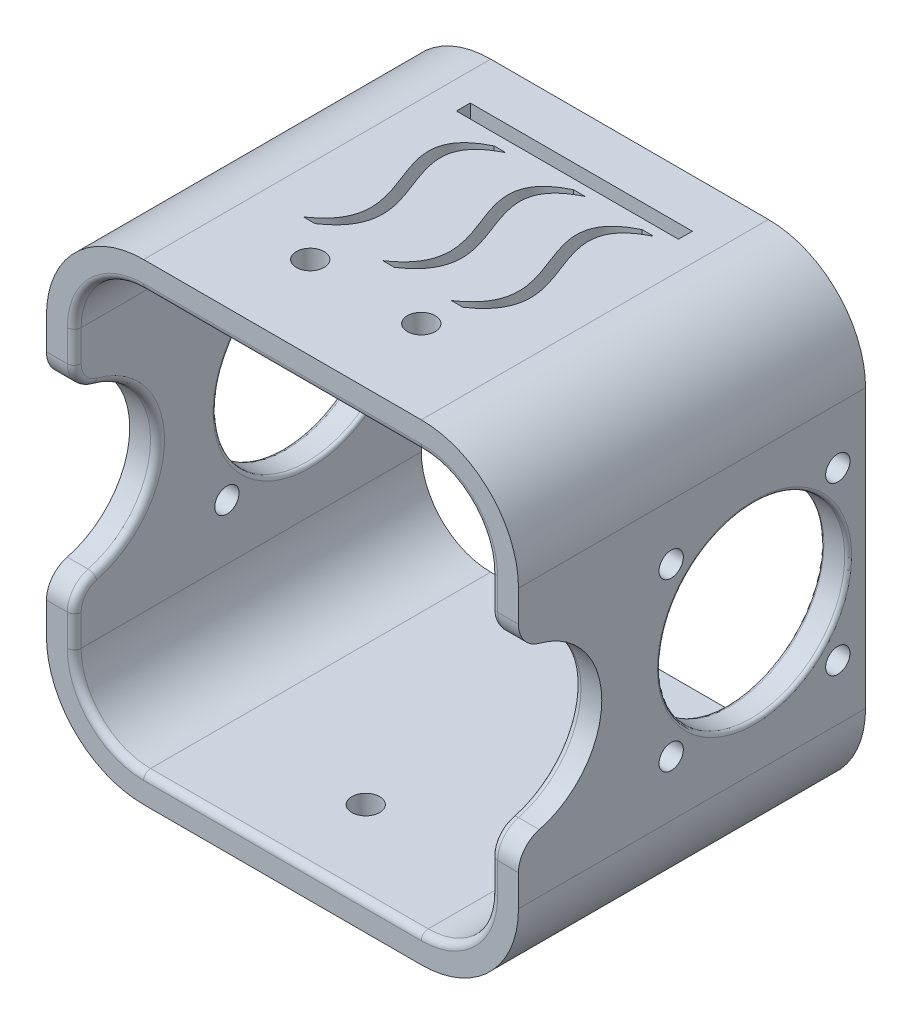
from build123d import *

# Parameters (mm, degrees)
ESTRUSIONE_SOTTILE1_DEPTH = 50
SCHIZZO2_R                = 2
TAGLIO_ESTRUSIONE1_DEPTH  = 10
SCHIZZO3_R                = 12
TAGLIO_ESTRUSIONE2_DEPTH  = 68
RACCORDO1_R               = 4
RACCORDO2_R               = 4
RACCORDO3_R               = 4
RACCORDO4_R               = 4
SCHIZZO4_R                = 2
TAGLIO_ESTRUSIONE3_DEPTH  = 10
SCHIZZO5_W                = 32
SCHIZZO5_H                = 2
TAGLIO_ESTRUSIONE4_DEPTH  = 10
TAGLIO_ESTRUSIONE5_REACH  = 107.925
SCHIZZO7_R                = 1.75
TAGLIO_ESTRUSIONE6_REACH  = 107.925
SCHIZZO8_R                = 13.5
RACCORDO5_R               = 0.5
RACCORDO6_R               = 0.5
RACCORDO7_R               = 0.5
RACCORDO8_R               = 0.5
RACCORDO9_R               = 1


with BuildPart() as part:
    # Schizzo1 → Estrusione-Sottile1 (new body)
    with BuildSketch(Plane.XY):
        with BuildLine():
            Line((-64, -10), (-64, -50))
            ThreePointArc((-64, -50), (-59.899494937, -59.899494937), (-50, -64))
            Line((-50, -64), (-10, -64))
            ThreePointArc((-10, -64), (-0.100505063, -59.899494937), (4, -50))
            Line((4, -50), (4, -10))
            ThreePointArc((4, -10), (-0.100505063, -0.100505063), (-10, 4))
            Line((-10, 4), (-50, 4))
            ThreePointArc((-50, 4), (-59.899494937, -0.100505063), (-64, -10))
        make_face()
        with BuildLine():
            Line((-60, -10), (-60, -50))
            ThreePointArc((-60, -50), (-57.071067812, -57.071067812), (-50, -60))
            Line((-50, -60), (-10, -60))
            ThreePointArc((-10, -60), (-2.928932188, -57.071067812), (0, -50))
            Line((0, -50), (0, -10))
            ThreePointArc((0, -10), (-2.928932188, -2.928932188), (-10, 0))
            Line((-10, 0), (-50, 0))
            ThreePointArc((-50, 0), (-57.071067812, -2.928932188), (-60, -10))
        make_face(mode=Mode.SUBTRACT)
    extrude(amount=ESTRUSIONE_SOTTILE1_DEPTH)

    # Schizzo2 → Taglio-Estrusione1 (cut)
    with BuildSketch(Plane(origin=(0, 4, 0), x_dir=(1, 0, 0), z_dir=(0, 1, 0))):
        with Locations(Location((-38, -38, 0), (0, 0, 180))):
            Circle(SCHIZZO2_R)
        with Locations(Location((-22, -38, 0), (0, 0, 180))):
            Circle(SCHIZZO2_R)
    extrude(amount=-TAGLIO_ESTRUSIONE1_DEPTH, mode=Mode.SUBTRACT)

    # Schizzo3 → Taglio-Estrusione2 (cut)
    with BuildSketch(Plane.ZY.offset(64)):
        with Locations((50, -30)):
            Circle(SCHIZZO3_R)
    extrude(amount=-TAGLIO_ESTRUSIONE2_DEPTH, mode=Mode.SUBTRACT)

    # Raccordo1
    raccordo1_edges = [part.edges().sort_by_distance(p)[0] for p in [
        (-62, -18, 50),
    ]]
    fillet(raccordo1_edges, radius=RACCORDO1_R)

    # Raccordo2
    raccordo2_edges = [part.edges().sort_by_distance(p)[0] for p in [
        (-62, -42, 50),
    ]]
    fillet(raccordo2_edges, radius=RACCORDO2_R)

    # Raccordo3
    raccordo3_edges = [part.edges().sort_by_distance(p)[0] for p in [
        (2, -18, 50),
    ]]
    fillet(raccordo3_edges, radius=RACCORDO3_R)

    # Raccordo4
    raccordo4_edges = [part.edges().sort_by_distance(p)[0] for p in [
        (2, -42, 50),
    ]]
    fillet(raccordo4_edges, radius=RACCORDO4_R)

    # Schizzo4 → Taglio-Estrusione3 (cut)
    with BuildSketch(Plane.XZ.offset(64)):
        with Locations((-30, 38)):
            Circle(SCHIZZO4_R)
    extrude(amount=-TAGLIO_ESTRUSIONE3_DEPTH, mode=Mode.SUBTRACT)

    # Schizzo5 → Taglio-Estrusione4 (cut)
    with BuildSketch(Plane(origin=(0, 4, 0), x_dir=(1, 0, 0), z_dir=(0, 1, 0))):
        with Locations((-30, -7.945849316)):
            Rectangle(SCHIZZO5_W, SCHIZZO5_H)
        with BuildLine():
            Line((-30.960454742, -32.928721256), (-32.639127219, -32.919533938))
            add(Edge.make_bspline(
                [(-27.742758505, -10.323050859), (-39.164938897, -15.912155443), (-21.882006837, -25.659406976), (-32.639127219, -32.919533938)],
                knots=[0, 0, 0, 0, 1, 1, 1, 1], degree=3))
            Line((-27.742758505, -10.323050859), (-26.064086029, -10.332238178))
            add(Edge.make_bspline(
                [(-26.064086029, -10.332238178), (-37.486266421, -15.921342761), (-20.203334361, -25.668594294), (-30.960454742, -32.928721256)],
                knots=[0, 0, 0, 0, 1, 1, 1, 1], degree=3))
        make_face()
        with BuildLine():
            Line((-42.135720019, -33.181656302), (-43.814392495, -33.172468983))
            add(Edge.make_bspline(
                [(-38.918023781, -10.575985905), (-50.340204173, -16.165090488), (-33.057272113, -25.912342021), (-43.814392495, -33.172468983)],
                knots=[0, 0, 0, 0, 1, 1, 1, 1], degree=3))
            Line((-38.918023781, -10.575985905), (-37.239351305, -10.585173223))
            add(Edge.make_bspline(
                [(-37.239351305, -10.585173223), (-48.661531697, -16.174277806), (-31.378599637, -25.921529339), (-42.135720019, -33.181656302)],
                knots=[0, 0, 0, 0, 1, 1, 1, 1], degree=3))
        make_face()
        with BuildLine():
            Line((-21.047266541, -32.963061307), (-22.725939017, -32.953873989))
            add(Edge.make_bspline(
                [(-17.829570303, -10.35739091), (-29.251750695, -15.946495494), (-11.968818635, -25.693747027), (-22.725939017, -32.953873989)],
                knots=[0, 0, 0, 0, 1, 1, 1, 1], degree=3))
            Line((-17.829570303, -10.35739091), (-16.150897827, -10.366578228))
            add(Edge.make_bspline(
                [(-16.150897827, -10.366578228), (-27.573078219, -15.955682812), (-10.290146159, -25.702934345), (-21.047266541, -32.963061307)],
                knots=[0, 0, 0, 0, 1, 1, 1, 1], degree=3))
        make_face()
    extrude(amount=-TAGLIO_ESTRUSIONE4_DEPTH, mode=Mode.SUBTRACT)

    # Taglio-Estrusione5: up to this face of the body (flat: up to its plane)
    taglio_estrusione5_end = Plane(part.part.faces().sort_by_distance((4, -30, 22.393243333))[0])
    # Schizzo7 → Taglio-Estrusione5 (cut, up to the picked face)
    with BuildSketch(Plane.ZY.offset(64), mode=Mode.PRIVATE) as taglio_estrusione5_sk1:
        with Locations(Location((28, -18, 0), (0, 0, 270))):
            Circle(SCHIZZO7_R)
    taglio_estrusione5_tool1 = split(extrude(taglio_estrusione5_sk1.sketch, amount=-TAGLIO_ESTRUSIONE5_REACH, mode=Mode.PRIVATE), bisect_by=taglio_estrusione5_end, keep=Keep.BOTH, mode=Mode.PRIVATE)
    # Schizzo7 → Taglio-Estrusione5 (cut, up to the picked face)
    with BuildSketch(Plane.ZY.offset(64), mode=Mode.PRIVATE) as taglio_estrusione5_sk2:
        with Locations(Location((28, -42, 0), (0, 0, 90))):
            Circle(SCHIZZO7_R)
    taglio_estrusione5_tool2 = split(extrude(taglio_estrusione5_sk2.sketch, amount=-TAGLIO_ESTRUSIONE5_REACH, mode=Mode.PRIVATE), bisect_by=taglio_estrusione5_end, keep=Keep.BOTH, mode=Mode.PRIVATE)
    # Schizzo7 → Taglio-Estrusione5 (cut, up to the picked face)
    with BuildSketch(Plane.ZY.offset(64), mode=Mode.PRIVATE) as taglio_estrusione5_sk3:
        with Locations(Location((4, -42, 0), (0, 0, 270))):
            Circle(SCHIZZO7_R)
    taglio_estrusione5_tool3 = split(extrude(taglio_estrusione5_sk3.sketch, amount=-TAGLIO_ESTRUSIONE5_REACH, mode=Mode.PRIVATE), bisect_by=taglio_estrusione5_end, keep=Keep.BOTH, mode=Mode.PRIVATE)
    # Schizzo7 → Taglio-Estrusione5 (cut, up to the picked face)
    with BuildSketch(Plane.ZY.offset(64), mode=Mode.PRIVATE) as taglio_estrusione5_sk4:
        with Locations(Location((4, -18, 0), (0, 0, 90))):
            Circle(SCHIZZO7_R)
    taglio_estrusione5_tool4 = split(extrude(taglio_estrusione5_sk4.sketch, amount=-TAGLIO_ESTRUSIONE5_REACH, mode=Mode.PRIVATE), bisect_by=taglio_estrusione5_end, keep=Keep.BOTH, mode=Mode.PRIVATE)
    add(taglio_estrusione5_tool1.solids().sort_by(Axis((-64, -18, 28), (1, 0, 0)))[0], mode=Mode.SUBTRACT)
    add(taglio_estrusione5_tool2.solids().sort_by(Axis((-64, -42, 28), (1, 0, 0)))[0], mode=Mode.SUBTRACT)
    add(taglio_estrusione5_tool3.solids().sort_by(Axis((-64, -42, 4), (1, 0, 0)))[0], mode=Mode.SUBTRACT)
    add(taglio_estrusione5_tool4.solids().sort_by(Axis((-64, -18, 4), (1, 0, 0)))[0], mode=Mode.SUBTRACT)

    # Taglio-Estrusione6: up to this face of the body (flat: up to its plane)
    taglio_estrusione6_end = Plane(part.part.faces().sort_by_distance((4, -30, 22.53539536))[0])
    # Schizzo8 → Taglio-Estrusione6 (cut, up to the picked face)
    with BuildSketch(Plane.ZY.offset(64), mode=Mode.PRIVATE) as taglio_estrusione6_sk1:
        with Locations(Location((16, -30, 0), (0, 0, 270))):
            Circle(SCHIZZO8_R)
    taglio_estrusione6_tool1 = split(extrude(taglio_estrusione6_sk1.sketch, amount=-TAGLIO_ESTRUSIONE6_REACH, mode=Mode.PRIVATE), bisect_by=taglio_estrusione6_end, keep=Keep.BOTH, mode=Mode.PRIVATE)
    add(taglio_estrusione6_tool1.solids().sort_by(Axis((-64, -30, 16), (1, 0, 0)))[0], mode=Mode.SUBTRACT)

    # Raccordo5
    raccordo5_edges = [part.edges().sort_by_distance(p)[0] for p in [
        (-64, -16.5, 16),
    ]]
    fillet(raccordo5_edges, radius=RACCORDO5_R)

    # Raccordo6
    raccordo6_edges = [part.edges().sort_by_distance(p)[0] for p in [
        (-60, -16.5, 16),
    ]]
    fillet(raccordo6_edges, radius=RACCORDO6_R)

    # Raccordo7
    raccordo7_edges = [part.edges().sort_by_distance(p)[0] for p in [
        (4, -16.5, 16),
    ]]
    fillet(raccordo7_edges, radius=RACCORDO7_R)

    # Raccordo8
    raccordo8_edges = [part.edges().sort_by_distance(p)[0] for p in [
        (0, -16.5, 16),
    ]]
    fillet(raccordo8_edges, radius=RACCORDO8_R)

    # Raccordo9
    raccordo9_edges = [part.edges().sort_by_distance(p)[0] for p in [
        (0, -43.042443642, 49.16227766),
        (-2.928932188, -57.071067812, 50),
        (0, -47.745966692, 50),
        (-2.928932188, -2.928932188, 50),
        (-30, 0, 50),
        (-57.071067812, -2.928932188, 50),
        (-60, -12.254033308, 50),
        (-57.071067812, -57.071067812, 50),
        (-30, -60, 50),
        (-60, -16.957556358, 49.16227766),
        (-60, -30, 38),
        (-60, -47.745966692, 50),
        (-60, -43.042443642, 49.16227766),
        (0, -30, 38),
        (0, -12.254033308, 50),
        (0, -16.957556358, 49.16227766),
    ]]
    fillet(raccordo9_edges, radius=RACCORDO9_R)


solid = part.part
